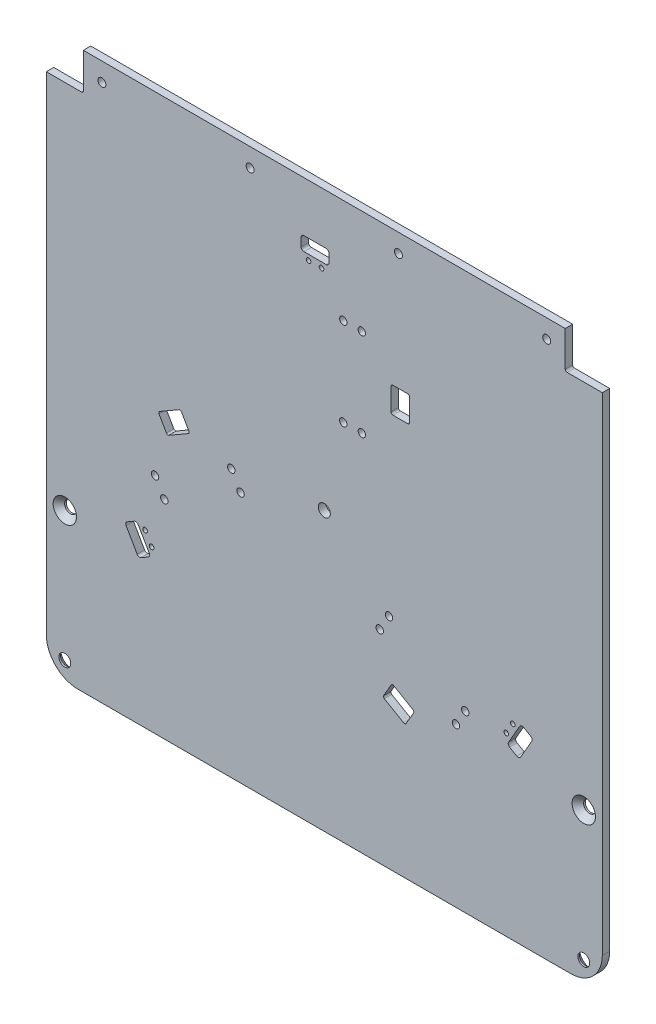
from build123d import *

# Parameters (mm, degrees)
SKIZZE1_W                                      = 300
SKIZZE1_H                                      = 300
SKIZZE1_R                                      = 3.25
AUFSATZ_LINEAR_AUSTRAGEN1_DEPTH                = 4
F_4_0_4_DURCHMESSER_BOHRUNG1_D                 = 4
M3_GEWINDEBOHRUNG1_AT_2_COUNT                  = 2
M3_GEWINDEBOHRUNG1_AT_2_PITCH                  = 7
SCHNITT_LINEAR_AUSTRAGEN2_REACH                = 426.283
SCHNITT_LINEAR_AUSTRAGEN4_REACH                = 426.283
KREISMUSTER1_COUNT                             = 3
SCHNITT_LINEAR_AUSTRAGEN3_REACH                = 426.283
FORMSENKUNG_F_R_M6_SENKSCHRAUBE_MIT_2_COUNT    = 2
FORMSENKUNG_F_R_M6_SENKSCHRAUBE_MIT_2_PITCH    = 280
F_4_3_4_3_DURCHMESSER_BOHRUNG1_D               = 4.3
FORMSENKUNG_F_R_M6_SENKSCHRAUBE_MIT_3_AT_COUNT = 2
FORMSENKUNG_F_R_M6_SENKSCHRAUBE_MIT_3_AT_PITCH = 280


with BuildPart() as part:
    # Skizze1 → Aufsatz-Linear austragen1 (new body)
    with BuildSketch(Plane.XY):
        with Locations((150, 150)):
            Rectangle(SKIZZE1_W, SKIZZE1_H)
        with Locations((150, 150)):
            Circle(SKIZZE1_R, mode=Mode.SUBTRACT)
    extrude(amount=AUFSATZ_LINEAR_AUSTRAGEN1_DEPTH)

    # Ø4.0 (4) Durchmesser Bohrung1 (through all)
    with Locations(Plane.XY.offset(4)):
        with Locations((160.25, 196.25), (170.25, 243.75), (160.25, 243.75), (170.25, 196.25)):
            f_4_0_4_durchmesser_bohrung1 = Hole(F_4_0_4_DURCHMESSER_BOHRUNG1_D / 2)

    # Skizze5 → M3 Gewindebohrung1 (revolve, cut)
    with BuildSketch(Plane(origin=(148.5, 262.5, 4), x_dir=(0, -1, 0), z_dir=(1, 0, 0))):
        Polygon((0, 0), (0, 9.251075774), (1.25, 8.5), (1.25, 0), align=None)
    m3_gewindebohrung1 = revolve(axis=Axis((148.5, 262.5, 10.35), (0, 0, -1)), mode=Mode.SUBTRACT)

    # M3 Gewindebohrung1 at 2: M3 Gewindebohrung1 ×2
    with Locations(*[(-i * M3_GEWINDEBOHRUNG1_AT_2_PITCH, 0, 0) for i in range(1, M3_GEWINDEBOHRUNG1_AT_2_COUNT)]):
        add(m3_gewindebohrung1, mode=Mode.SUBTRACT)

    # Skizze9 → Schnitt-Linear austragen2 (cut, up to next)
    with BuildSketch(Plane.XY.offset(4), mode=Mode.PRIVATE) as schnitt_linear_austragen2_sk1:
        with BuildLine():
            Line((139, 272.9), (151, 272.9))
            ThreePointArc((151, 272.9), (152.060660172, 272.460660172), (152.5, 271.4))
            Line((152.5, 271.4), (152.5, 266.9))
            ThreePointArc((152.5, 266.9), (152.060660172, 265.839339828), (151, 265.4))
            Line((151, 265.4), (139, 265.4))
            ThreePointArc((139, 265.4), (137.939339828, 265.839339828), (137.5, 266.9))
            Line((137.5, 266.9), (137.5, 271.4))
            ThreePointArc((137.5, 271.4), (137.939339828, 272.460660172), (139, 272.9))
        make_face()
    schnitt_linear_austragen2_tool1 = extrude(schnitt_linear_austragen2_sk1.sketch, amount=-SCHNITT_LINEAR_AUSTRAGEN2_REACH, mode=Mode.PRIVATE) & part.part
    schnitt_linear_austragen2 = schnitt_linear_austragen2_tool1.solids().sort_by_distance((145, 269.15, 4))[0]
    add(schnitt_linear_austragen2, mode=Mode.SUBTRACT)

    # Skizze16 → Schnitt-Linear austragen4 (cut, up to next)
    with BuildSketch(Plane.XY.offset(4), mode=Mode.PRIVATE) as schnitt_linear_austragen4_sk1:
        with BuildLine():
            Line((195, 227), (187, 227))
            ThreePointArc((187, 227), (186.292893219, 226.707106781), (186, 226))
            Line((186, 226), (186, 214))
            ThreePointArc((186, 214), (186.292893219, 213.292893219), (187, 213))
            Line((187, 213), (195, 213))
            ThreePointArc((195, 213), (195.707106781, 213.292893219), (196, 214))
            Line((196, 214), (196, 226))
            ThreePointArc((196, 226), (195.707106781, 226.707106781), (195, 227))
        make_face()
    schnitt_linear_austragen4_tool1 = extrude(schnitt_linear_austragen4_sk1.sketch, amount=-SCHNITT_LINEAR_AUSTRAGEN4_REACH, mode=Mode.PRIVATE) & part.part
    schnitt_linear_austragen4 = schnitt_linear_austragen4_tool1.solids().sort_by_distance((191, 220, 4))[0]
    add(schnitt_linear_austragen4, mode=Mode.SUBTRACT)

    # Kreismuster1: Ø4.0 (4) Durchmesser Bohrung1, M3 Gewindebohrung1, Schnitt-Linear austragen2, Schnitt-Linear austragen4 ×3 about axis
    kreismuster1_axis = Axis((150, 150, 0), (0, 0, 1))
    add([f_4_0_4_durchmesser_bohrung1.rotate(kreismuster1_axis, i * 360 / KREISMUSTER1_COUNT) for i in range(1, KREISMUSTER1_COUNT)], mode=Mode.SUBTRACT)
    add([m3_gewindebohrung1.rotate(kreismuster1_axis, i * 360 / KREISMUSTER1_COUNT) for i in range(1, KREISMUSTER1_COUNT)], mode=Mode.SUBTRACT)
    add([schnitt_linear_austragen2.rotate(kreismuster1_axis, i * 360 / KREISMUSTER1_COUNT) for i in range(1, KREISMUSTER1_COUNT)], mode=Mode.SUBTRACT)
    add([schnitt_linear_austragen4.rotate(kreismuster1_axis, i * 360 / KREISMUSTER1_COUNT) for i in range(1, KREISMUSTER1_COUNT)], mode=Mode.SUBTRACT)

    # Kreismuster1 copy 1 sketch → Kreismuster1 copy 1 (revolve, cut)
    with BuildSketch(Plane(origin=(56.822142074, 86.388784068, 4), x_dir=(0.8660254037844387, 0.4999999999999998, 0), z_dir=(-0.4999999999999998, 0.8660254037844387, 0))):
        Polygon((0, 0), (0, 9.251075774), (1.25, 8.5), (1.25, 0), align=None)
    revolve(axis=Axis((56.822142074, 86.388784068, 10.35), (0, 0, -1)), mode=Mode.SUBTRACT)

    # Kreismuster1 copy 2 sketch → Kreismuster1 copy 2 (revolve, cut)
    with BuildSketch(Plane(origin=(251.677857926, 101.111215932, 4), x_dir=(-0.8660254037844384, 0.5000000000000004, 0), z_dir=(-0.5000000000000004, -0.8660254037844384, 0))):
        Polygon((0, 0), (0, 9.251075774), (1.25, 8.5), (1.25, 0), align=None)
    revolve(axis=Axis((251.677857926, 101.111215932, 10.35), (0, 0, -1)), mode=Mode.SUBTRACT)

    # Skizze12 → Schnitt-Linear austragen3 (cut, up to next)
    with BuildSketch(Plane(origin=(0, 0, 0), x_dir=(-1, 0, 0), z_dir=(0, 0, -1)), mode=Mode.PRIVATE) as schnitt_linear_austragen3_sk1:
        with BuildLine():
            Line((-300, 17), (-300, 0))
            Line((-300, 0), (-283, 0))
            ThreePointArc((-283, 0), (-295.02081528, 4.97918472), (-300, 17))
        make_face()
    schnitt_linear_austragen3_tool1 = extrude(schnitt_linear_austragen3_sk1.sketch, amount=-SCHNITT_LINEAR_AUSTRAGEN3_REACH, mode=Mode.PRIVATE) & part.part
    # Skizze12 → Schnitt-Linear austragen3 (cut, up to next)
    with BuildSketch(Plane(origin=(0, 0, 0), x_dir=(-1, 0, 0), z_dir=(0, 0, -1)), mode=Mode.PRIVATE) as schnitt_linear_austragen3_sk2:
        with BuildLine():
            Line((-300, 300), (-280, 300))
            Line((-280, 300), (-280, 281))
            ThreePointArc((-280, 281), (-280.292893219, 280.292893219), (-281, 280))
            Line((-281, 280), (-300, 280))
            Line((-300, 280), (-300, 300))
        make_face()
    schnitt_linear_austragen3_tool2 = extrude(schnitt_linear_austragen3_sk2.sketch, amount=-SCHNITT_LINEAR_AUSTRAGEN3_REACH, mode=Mode.PRIVATE) & part.part
    # Skizze12 → Schnitt-Linear austragen3 (cut, up to next)
    with BuildSketch(Plane(origin=(0, 0, 0), x_dir=(-1, 0, 0), z_dir=(0, 0, -1)), mode=Mode.PRIVATE) as schnitt_linear_austragen3_sk3:
        with BuildLine():
            Line((0, 300), (-20, 300))
            Line((-20, 300), (-20, 281))
            ThreePointArc((-20, 281), (-19.707106781, 280.292893219), (-19, 280))
            Line((-19, 280), (0, 280))
            Line((0, 280), (0, 300))
        make_face()
    schnitt_linear_austragen3_tool3 = extrude(schnitt_linear_austragen3_sk3.sketch, amount=-SCHNITT_LINEAR_AUSTRAGEN3_REACH, mode=Mode.PRIVATE) & part.part
    # Skizze12 → Schnitt-Linear austragen3 (cut, up to next)
    with BuildSketch(Plane(origin=(0, 0, 0), x_dir=(-1, 0, 0), z_dir=(0, 0, -1)), mode=Mode.PRIVATE) as schnitt_linear_austragen3_sk4:
        with BuildLine():
            Line((-17, 0), (0, 0))
            Line((0, 0), (0, 17))
            ThreePointArc((0, 17), (-4.97918472, 4.97918472), (-17, 0))
        make_face()
    schnitt_linear_austragen3_tool4 = extrude(schnitt_linear_austragen3_sk4.sketch, amount=-SCHNITT_LINEAR_AUSTRAGEN3_REACH, mode=Mode.PRIVATE) & part.part
    add(schnitt_linear_austragen3_tool1.solids().sort_by_distance((296.202745, 3.797255, 0))[0], mode=Mode.SUBTRACT)
    add(schnitt_linear_austragen3_tool2.solids().sort_by_distance((290.005248, 290.005248, 0))[0], mode=Mode.SUBTRACT)
    add(schnitt_linear_austragen3_tool3.solids().sort_by_distance((9.994752, 290.005248, 0))[0], mode=Mode.SUBTRACT)
    add(schnitt_linear_austragen3_tool4.solids().sort_by_distance((3.797255, 3.797255, 0))[0], mode=Mode.SUBTRACT)

    # Skizze14 → Formsenkung f_r M6 Senkschraube mit Schl (revolve, cut)
    with BuildSketch(Plane(origin=(290, 10, 0), x_dir=(0, 1, 0), z_dir=(1, 0, 0))):
        Polygon((0, 0), (0, 4), (3.2, 4), (3.2, 3.1), (6.3, 0), align=None)
    formsenkung_f_r_m6_senkschraube_mit_schl = revolve(axis=Axis((290, 10, -6.35), (0, 0, 1)), mode=Mode.SUBTRACT)

    # Formsenkung f_r M6 Senkschraube mit  2: Formsenkung f_r M6 Senkschraube mit Schl ×2
    with Locations(*[(-i * FORMSENKUNG_F_R_M6_SENKSCHRAUBE_MIT_2_PITCH, 0, 0) for i in range(1, FORMSENKUNG_F_R_M6_SENKSCHRAUBE_MIT_2_COUNT)]):
        add(formsenkung_f_r_m6_senkschraube_mit_schl, mode=Mode.SUBTRACT)

    # Ø4.3 (4.3) Durchmesser Bohrung1 (through all)
    with Locations(Plane.XY.offset(4)):
        with Locations((30, 290), (110, 290), (190, 290), (270, 290)):
            Hole(F_4_3_4_3_DURCHMESSER_BOHRUNG1_D / 2)

    # Skizze19 → Formsenkung f_r M6 Senkschraube mit  3 (revolve, cut)
    with BuildSketch(Plane(origin=(10, 80, 4), x_dir=(0, -1, 0), z_dir=(1, 0, 0))):
        Polygon((0, 0), (0, 4), (3.2, 4), (3.2, 3.1), (6.3, 0), align=None)
    formsenkung_f_r_m6_senkschraube_mit_3 = revolve(axis=Axis((10, 80, 10.35), (0, 0, -1)), mode=Mode.SUBTRACT)

    # Formsenkung f_r M6 Senkschraube mit 3 at: Formsenkung f_r M6 Senkschraube mit  3 ×2
    with Locations(*[(i * FORMSENKUNG_F_R_M6_SENKSCHRAUBE_MIT_3_AT_PITCH, 0, 0) for i in range(1, FORMSENKUNG_F_R_M6_SENKSCHRAUBE_MIT_3_AT_COUNT)]):
        add(formsenkung_f_r_m6_senkschraube_mit_3, mode=Mode.SUBTRACT)


solid = part.part
